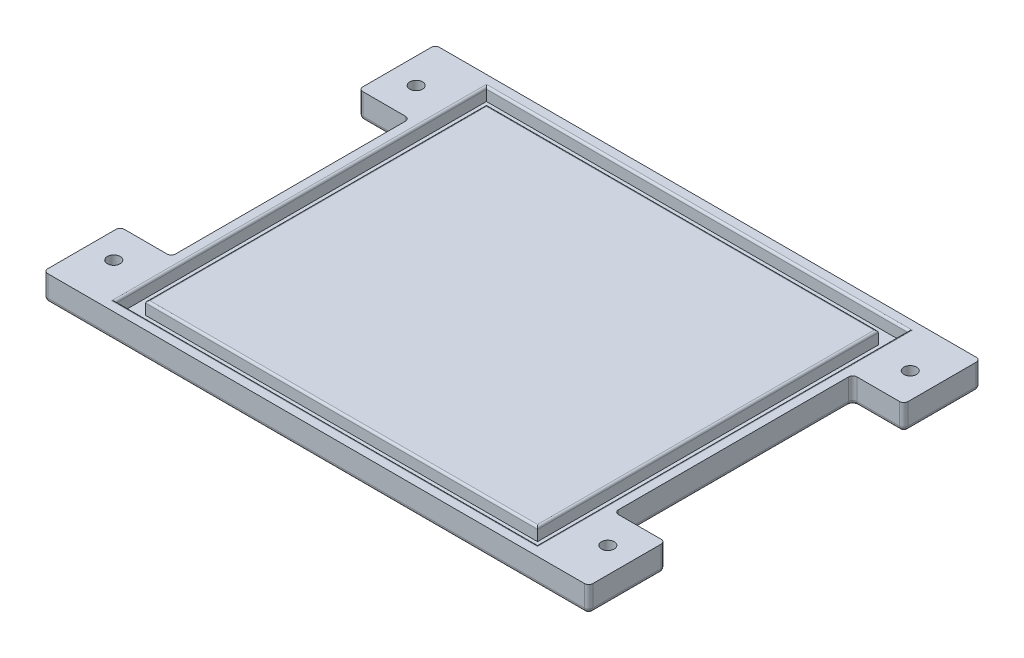
from build123d import *

# Parameters (mm, degrees)
ESBO_O1_W                = 104
ESBO_O1_H                = 92
RESSALTO_EXTRUS_O1_DEPTH = 6
ESBO_O2_W                = 99
ESBO_O2_H                = 87
ESBO_O2_W_2              = 92
ESBO_O2_H_2              = 80
CORTE_EXTRUS_O1_DEPTH    = 3
FILETE1_R                = 0.5
ESBO_O4_W                = 12
ESBO_O4_H                = 15
RESSALTO_EXTRUS_O2_DEPTH = 6
ESBO_O5_R                = 1.5
CORTE_EXTRUS_O2_DEPTH    = 6
ESBO_O6_R                = 2.5
CORTE_EXTRUS_O3_DEPTH    = 2
ESBO_O7_W                = 7.98030821
ESBO_O7_H                = 9.10209211
ESBO_O7_W_2              = 6.596398378
ESBO_O7_H_2              = 10.359534239
ESBO_O7_H_3              = 10.002698729
ESBO_O7_W_3              = 6.159268442
ESBO_O7_H_4              = 8.534598922
RESSALTO_EXTRUS_O3_DEPTH = 6
ESBO_O8_W                = 5.104715184
ESBO_O8_H                = 5.727823056
RESSALTO_EXTRUS_O4_DEPTH = 6
ESBO_O9_W                = 12
ESBO_O9_H                = 18
RESSALTO_EXTRUS_O6_DEPTH = 6
ESBO_O10_R               = 1.5
CORTE_EXTRUS_O5_DEPTH    = 10
ESBO_O11_R               = 1.5
CORTE_EXTRUS_O6_DEPTH    = 10
FILETE8_R                = 1


with BuildPart() as part:
    # Esboço1 → Ressalto-extrusão1 (new body)
    with BuildSketch(Plane(origin=(0, 0, 0), x_dir=(1, 0, 0), z_dir=(0, 1, 0))):
        with Locations((-52, 46)):
            Rectangle(ESBO_O1_W, ESBO_O1_H)
    extrude(amount=RESSALTO_EXTRUS_O1_DEPTH)

    # Esboço2 → Corte-extrusão1 (cut)
    with BuildSketch(Plane(origin=(0, 6, 0), x_dir=(1, 0, 0), z_dir=(0, 1, 0))):
        with Locations((-52, 46)):
            Rectangle(ESBO_O2_W, ESBO_O2_H)
        with Locations((-52, 46)):
            Rectangle(ESBO_O2_W_2, ESBO_O2_H_2, mode=Mode.SUBTRACT)
    extrude(amount=-CORTE_EXTRUS_O1_DEPTH, mode=Mode.SUBTRACT)

    # Filete1
    filete1_edges = [part.edges().sort_by_distance(p)[0] for p in [
        (-6, 6, -46),
        (-52, 6, -86),
        (-2.5, 6, -46),
        (-52, 6, -89.5),
        (-101.5, 6, -46),
        (-52, 6, -2.5),
        (-52, 6, -6),
        (-98, 6, -46),
    ]]
    fillet(filete1_edges, radius=FILETE1_R)

    # Esboço4 → Ressalto-extrusão2 (add)
    with BuildSketch(Plane(origin=(0, 6, 0), x_dir=(1, 0, 0), z_dir=(0, 1, 0))):
        with Locations((-110, 84.5)):
            Rectangle(ESBO_O4_W, ESBO_O4_H)
        with Locations((-110, 7.5)):
            Rectangle(ESBO_O4_W, ESBO_O4_H)
        with Locations((6, 84.5)):
            Rectangle(ESBO_O4_W, ESBO_O4_H)
        with Locations((6, 7.5)):
            Rectangle(ESBO_O4_W, ESBO_O4_H)
    extrude(amount=-RESSALTO_EXTRUS_O2_DEPTH)

    # Esboço5 → Corte-extrusão2 (cut)
    with BuildSketch(Plane(origin=(0, 6, 0), x_dir=(1, 0, 0), z_dir=(0, 1, 0))):
        with Locations(Location((-110, 84.5, 0), (0, 0, 270))):
            Circle(ESBO_O5_R)
        with Locations(Location((6, 84.5, 0), (0, 0, 270))):
            Circle(ESBO_O5_R)
        with Locations(Location((6, 7.5, 0), (0, 0, 270))):
            Circle(ESBO_O5_R)
        with Locations(Location((-110, 7.5, 0), (0, 0, 270))):
            Circle(ESBO_O5_R)
    extrude(amount=-CORTE_EXTRUS_O2_DEPTH, mode=Mode.SUBTRACT)

    # Esboço6 → Corte-extrusão3 (cut)
    with BuildSketch(Plane.XZ):
        with Locations(Location((-110, -7.5, 0), (0, 0, 270))):
            Circle(ESBO_O6_R)
        with Locations(Location((6, -7.5, 0), (0, 0, 270))):
            Circle(ESBO_O6_R)
        with Locations(Location((6, -84.5, 0), (0, 0, 270))):
            Circle(ESBO_O6_R)
        with Locations(Location((-110, -84.5, 0), (0, 0, 270))):
            Circle(ESBO_O6_R)
    extrude(amount=-CORTE_EXTRUS_O3_DEPTH, mode=Mode.SUBTRACT)

    # Esboço7 → Ressalto-extrusão3 (add)
    with BuildSketch(Plane(origin=(0, 6, 0), x_dir=(1, 0, 0), z_dir=(0, 1, 0))):
        with Locations((5.307816373, 84.855833867)):
            Rectangle(ESBO_O7_W, ESBO_O7_H)
        with Locations((-110.167606883, 84.227112803)):
            Rectangle(ESBO_O7_W_2, ESBO_O7_H_2)
        with Locations((-110.167606883, 7.052412752)):
            Rectangle(ESBO_O7_W_2, ESBO_O7_H_3)
        with Locations((6.218336257, 7.786462655)):
            Rectangle(ESBO_O7_W_3, ESBO_O7_H_4)
    extrude(amount=-RESSALTO_EXTRUS_O3_DEPTH)

    # Esboço8 → Ressalto-extrusão4 (add)
    with BuildSketch(Plane.XZ):
        with Locations((3.170040608, -7.80145261)):
            Rectangle(ESBO_O8_W, ESBO_O8_H)
    extrude(amount=-RESSALTO_EXTRUS_O4_DEPTH)

    # Esboço9 → Ressalto-extrusão6 (add)
    with BuildSketch(Plane(origin=(0, 0, 0), x_dir=(-1, 0, 0), z_dir=(0, -1, 0))):
        with Locations((110, 83)):
            Rectangle(ESBO_O9_W, ESBO_O9_H)
        with Locations((-6, 83)):
            Rectangle(ESBO_O9_W, ESBO_O9_H)
        with Locations((110, 9)):
            Rectangle(ESBO_O9_W, ESBO_O9_H)
        with Locations((-6, 9)):
            Rectangle(ESBO_O9_W, ESBO_O9_H)
    extrude(amount=-RESSALTO_EXTRUS_O6_DEPTH)

    # Esboço10 → Corte-extrusão5 (cut)
    with BuildSketch(Plane.XZ):
        with Locations(Location((-110, -10.5, 0), (0, 0, 270))):
            Circle(ESBO_O10_R)
    extrude(amount=-CORTE_EXTRUS_O5_DEPTH, mode=Mode.SUBTRACT)

    # Esboço11 → Corte-extrusão6 (cut)
    with BuildSketch(Plane(origin=(0, 6, 0), x_dir=(1, 0, 0), z_dir=(0, 1, 0))):
        with Locations(Location((-110, 81.5, 0), (0, 0, 270))):
            Circle(ESBO_O11_R)
        with Locations(Location((6, 81.5, 0), (0, 0, 270))):
            Circle(ESBO_O11_R)
        with Locations(Location((6, 10.5, 0), (0, 0, 270))):
            Circle(ESBO_O11_R)
    extrude(amount=-CORTE_EXTRUS_O6_DEPTH, mode=Mode.SUBTRACT)

    # Filete8
    filete8_edges = [part.edges().sort_by_distance(p)[0] for p in [
        (-104, 3, -18),
        (-116, 3, -18),
        (-116, 3, 0),
        (-104, 3, -74),
        (-110, 0, -74),
        (-116, 3, -74),
        (-110, 0, -83),
        (-116, 0, -83),
        (-116, 3, -92),
        (12, 3, -92),
        (0, 3, -18),
        (12, 3, -18),
        (12, 3, 0),
        (0, 3, -74),
        (12, 3, -74),
        (-52, 0, -92),
        (6, 0, -83),
        (6, 0, -74),
        (12, 0, -83),
        (0, 0, -46),
        (6, 0, -18),
        (6, 0, -12),
        (12, 0, -9),
        (-104, 0, -46),
        (-110, 0, -18),
        (-116, 0, -9),
        (-110, 0, -9),
        (-52, 0, 0),
    ]]
    fillet(filete8_edges, radius=FILETE8_R)


solid = part.part
